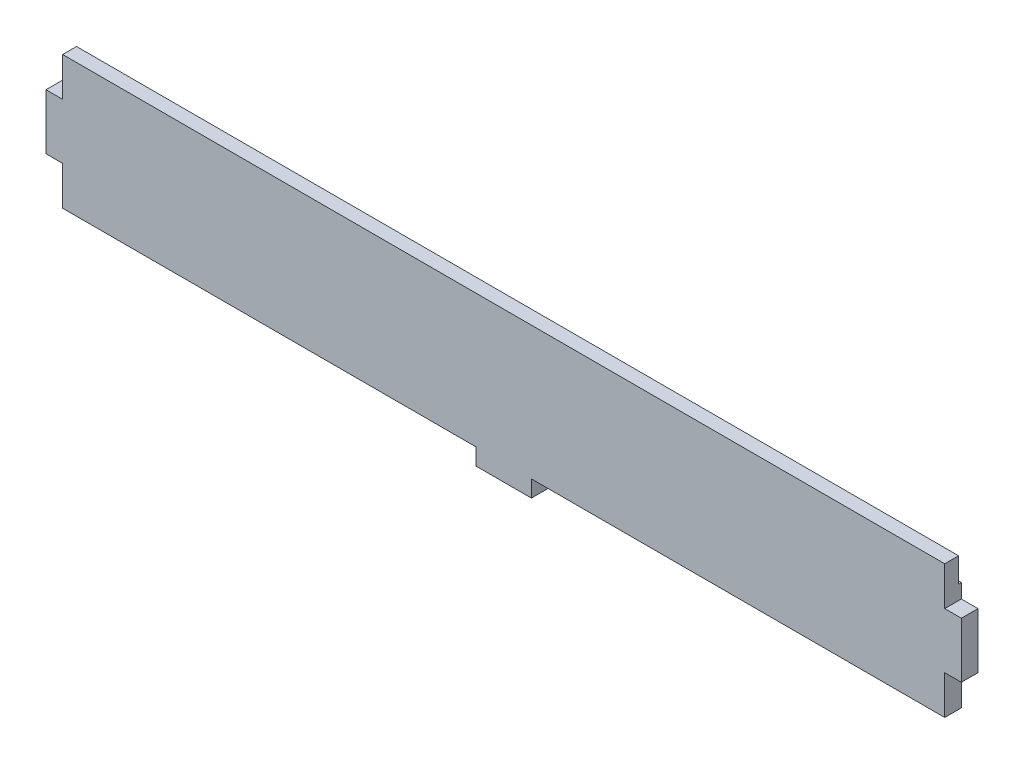
from build123d import *

# Parameters (mm, degrees)
ESQUISSE1_W             = 330
ESQUISSE1_H             = 54
BOSS_EXTRU_1_DEPTH      = 6
ESQUISSE2_W             = 6
ESQUISSE2_H             = 14
ENL_V_MAT_EXTRU_1_DEPTH = 335.442820225
ESQUISSE4_W             = 318
ESQUISSE4_H             = 8.870374263
ENL_V_MAT_EXTRU_2_DEPTH = 1


with BuildPart() as part:
    # Esquisse1 → Boss.-Extru.1 (new body)
    with BuildSketch(Plane.XY):
        with Locations((-165, 27)):
            Rectangle(ESQUISSE1_W, ESQUISSE1_H)
    extrude(amount=BOSS_EXTRU_1_DEPTH)

    # Esquisse2 → Enlèv. mat.-Extru.1 (cut, through all)
    with BuildSketch(Plane.XY.offset(6)):
        Polygon((-330, 0), (-175, 0), (-175, 6), (-324, 6), (-324, 20), (-330, 20), align=None)
        with Locations((-327, 47)):
            Rectangle(ESQUISSE2_W, ESQUISSE2_H)
        Polygon((-155, 0), (0, 0), (0, 20), (-6, 20), (-6, 6), (-155, 6), align=None)
        with Locations((-3, 47)):
            Rectangle(ESQUISSE2_W, ESQUISSE2_H)
    extrude(amount=-ENL_V_MAT_EXTRU_1_DEPTH, mode=Mode.SUBTRACT)

    # Esquisse4 → Enlèv. mat.-Extru.2 (cut)
    with BuildSketch(Plane(origin=(0, 0, 0), x_dir=(-1, 0, 0), z_dir=(0, 0, -1))):
        with Locations((165, 49.564812868)):
            Rectangle(ESQUISSE4_W, ESQUISSE4_H)
    extrude(amount=-ENL_V_MAT_EXTRU_2_DEPTH, mode=Mode.SUBTRACT)


solid = part.part
